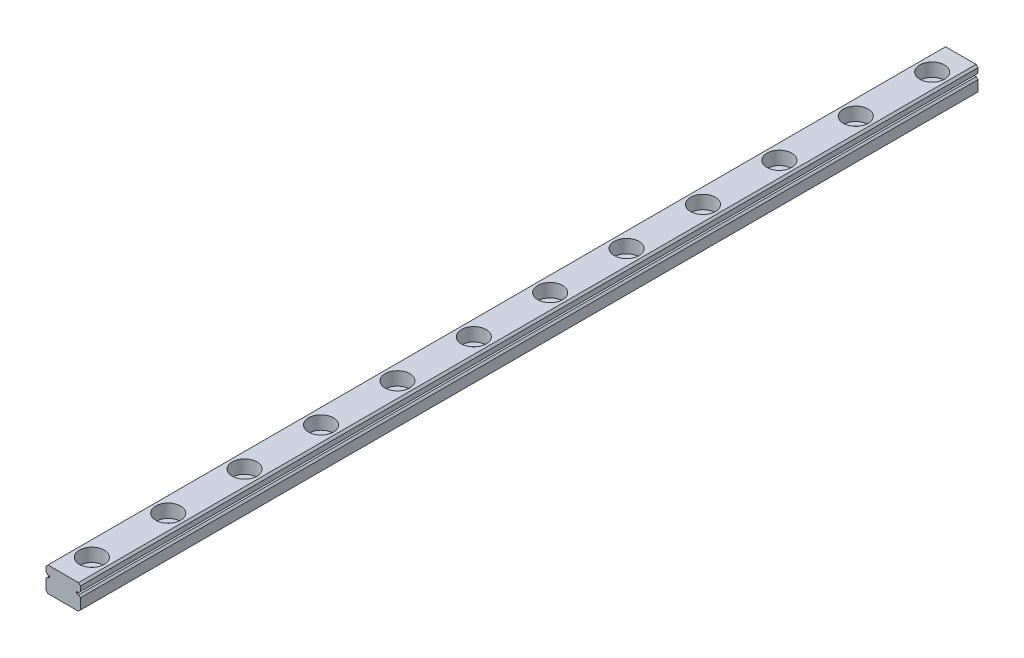
from build123d import *

# Parameters (mm, degrees)
EXTRUDE_1_DEPTH        = 117.5
SKETCH_2_R             = 1.75
CUT_EXTRUDE_1_DEPTH    = 118.765657133
CHAMFER_1_SIZE         = 0.5
SKETCH_3_R             = 3.25
CUT_EXTRUDE_2_DEPTH    = 3.5
PATTERN_LINEAR_1_COUNT = 12
PATTERN_LINEAR_1_PITCH = 20


with BuildPart() as part:
    # 草图1 → 凸台-拉伸1 (new, symmetric)
    with BuildSketch(Plane.XY):
        Polygon((4.5, 0), (-4.5, 0), (-4.5, 3.292893219), (-4.042893219, 3.75), (-3.542893219, 3.75), (-3.542893219, 4.25), (-4.042893219, 4.25), (-4.5, 4.707106781), (-4.5, 6.5), (4.5, 6.5), (4.5, 4.707106781), (4.042893219, 4.25), (3.542893219, 4.25), (3.542893219, 3.75), (4.042893219, 3.75), (4.5, 3.292893219), align=None)
    extrude(amount=EXTRUDE_1_DEPTH, both=True)

    # 草图2 → 切除-拉伸1 (cut, through all)
    with BuildSketch(Plane(origin=(0, 6.5, 0), x_dir=(1, 0, 0), z_dir=(0, 1, 0))):
        with Locations(Location((0, 110, 0), (0, 0, 180))):
            Circle(SKETCH_2_R)
        with Locations(Location((0, 90, 0), (0, 0, 180))):
            Circle(SKETCH_2_R)
        with Locations(Location((0, 70, 0), (0, 0, 180))):
            Circle(SKETCH_2_R)
        with Locations(Location((0, 50, 0), (0, 0, 180))):
            Circle(SKETCH_2_R)
        with Locations(Location((0, 30, 0), (0, 0, 180))):
            Circle(SKETCH_2_R)
        with Locations(Location((0, 10, 0), (0, 0, 180))):
            Circle(SKETCH_2_R)
        with Locations(Location((0, -10, 0), (0, 0, 180))):
            Circle(SKETCH_2_R)
        with Locations(Location((0, -30, 0), (0, 0, 180))):
            Circle(SKETCH_2_R)
        with Locations(Location((0, -50, 0), (0, 0, 180))):
            Circle(SKETCH_2_R)
        with Locations(Location((0, -70, 0), (0, 0, 180))):
            Circle(SKETCH_2_R)
        with Locations(Location((0, -90, 0), (0, 0, 180))):
            Circle(SKETCH_2_R)
        with Locations(Location((0, -110, 0), (0, 0, 180))):
            Circle(SKETCH_2_R)
    extrude(amount=-CUT_EXTRUDE_1_DEPTH, mode=Mode.SUBTRACT)

    # 倒角1
    chamfer_1_edges = [part.edges().sort_by_distance(p)[0] for p in [
        (-4.5, 6.5, 0),
        (4.5, 6.5, 0),
        (4.5, 0, 0),
        (-4.5, 0, 0),
    ]]
    chamfer(chamfer_1_edges, length=CHAMFER_1_SIZE)

    # 草图3 → 切除-拉伸2 (cut)
    with BuildSketch(Plane(origin=(0, 6.5, 0), x_dir=(1, 0, 0), z_dir=(0, 1, 0))):
        with Locations(Location((0, 110, 0), (0, 0, 180))):
            Circle(SKETCH_3_R)
    cut_extrude_2 = extrude(amount=-CUT_EXTRUDE_2_DEPTH, mode=Mode.SUBTRACT)

    # 阵列(线性)1: 切除-拉伸2 ×12
    with Locations(*[(0, 0, i * PATTERN_LINEAR_1_PITCH) for i in range(1, PATTERN_LINEAR_1_COUNT)]):
        add(cut_extrude_2, mode=Mode.SUBTRACT)


solid = part.part
